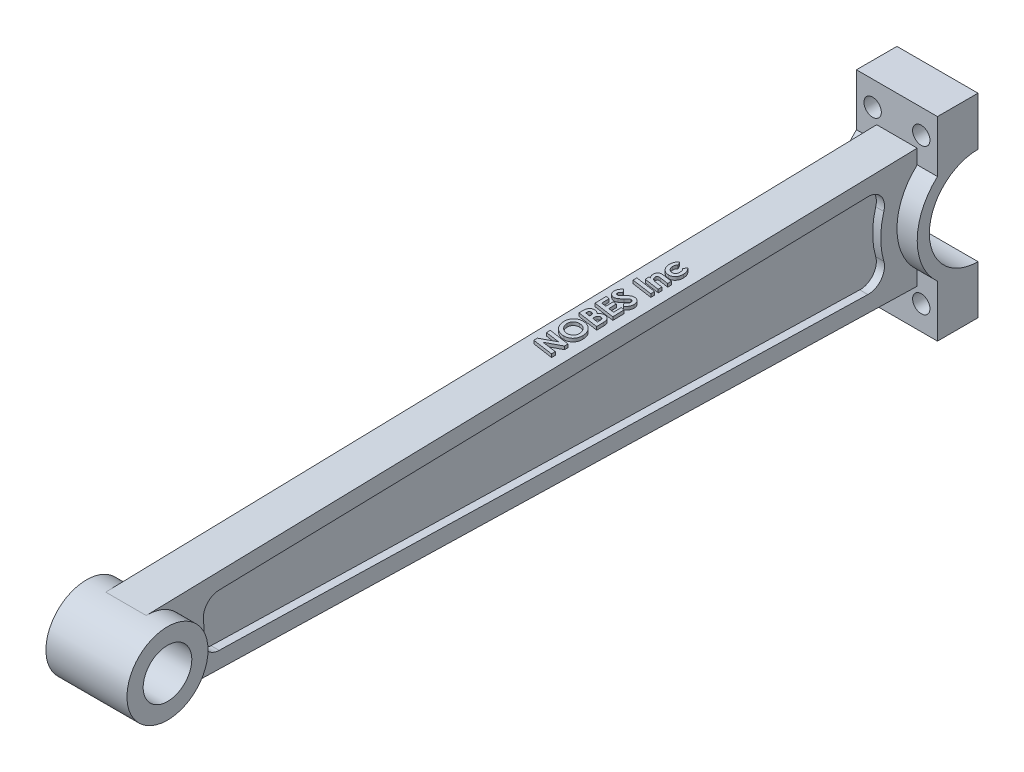
from build123d import *

# Parameters (mm, degrees)
JOURNAL_BOSS_DEPTH      = 25
SKETCH2_R               = 25
SKETCH2_R_2             = 15
PINION_BOSS_DEPTH       = 25
BOSS_EXTRUDE3_DEPTH     = 12.5
CUT_EXTRUDE1_DEPTH      = 5
F_1_2_13_TAPPED_HOLE1_D = 10.71626
BOSS_EXTRUDE4_DEPTH     = 2


with BuildPart() as part:
    # Sketch1 → Journal_Boss (new, symmetric)
    with BuildSketch(Plane(origin=(0, 0, 0), x_dir=(0, 0, -1), z_dir=(1, 0, 0))):
        with BuildLine():
            Line((-25, 27.950849719), (-25, 60))
            Line((-25, 60), (0, 60))
            Line((0, 60), (0, 30))
            ThreePointArc((0, 30), (-30, 0), (0, -30))
            Line((0, -30), (0, -60))
            Line((0, -60), (-25, -60))
            Line((-25, -60), (-25, -27.950849719))
            ThreePointArc((-25, -27.950849719), (-37.5, 0), (-25, 27.950849719))
        make_face()
    extrude(amount=JOURNAL_BOSS_DEPTH, both=True)



with BuildPart() as body_2:
    # Sketch2 → Pinion_Boss (new, symmetric)
    with BuildSketch(Plane(origin=(0, 0, 0), x_dir=(0, 0, -1), z_dir=(1, 0, 0))):
        with Locations((-500, 0)):
            Circle(SKETCH2_R)
        with Locations((-500, 0)):
            Circle(SKETCH2_R_2, mode=Mode.SUBTRACT)
    extrude(amount=PINION_BOSS_DEPTH, both=True)


with BuildPart() as part_1:
    add(part.part)

    add(body_2.part)  # Boss-Extrude3 merges body 2
    # Sketch3 → Boss-Extrude3 (add, symmetric)
    with BuildSketch(Plane(origin=(0, 0, 0), x_dir=(0, 0, -1), z_dir=(1, 0, 0))):
        with BuildLine():
            Line((-500.625, 24.992186279), (-0.9375, 37.488279418))
            ThreePointArc((-0.9375, 37.488279418), (-37.5, 0), (-0.9375, -37.488279418))
            Line((-0.9375, -37.488279418), (-500.625, -24.992186279))
            ThreePointArc((-500.625, -24.992186279), (-475, 0), (-500.625, 24.992186279))
        make_face()
    extrude(amount=BOSS_EXTRUDE3_DEPTH, both=True)

    # Sketch4 → Cut-Extrude1 (cut)
    with BuildSketch(Plane(origin=(12.5, 0, 0), x_dir=(0, 0, -1), z_dir=(1, 0, 0))):
        with BuildLine():
            Line((-55.442636745, 26.122098513), (-455.667618059, 16.113345756))
            ThreePointArc((-455.667618059, 16.113345756), (-463.035515049, 12.594715254), (-465.324814046, 4.757255412))
            ThreePointArc((-465.324814046, 4.757255412), (-465, 0), (-465.324814046, -4.757255412))
            ThreePointArc((-465.324814046, -4.757255412), (-463.035515049, -12.594715254), (-455.667618059, -16.113345756))
            Line((-455.667618059, -16.113345756), (-55.442636745, -26.122098513))
            ThreePointArc((-55.442636745, -26.122098513), (-47.26687423, -22.222952148), (-45.593917311, -13.320837219))
            ThreePointArc((-45.593917311, -13.320837219), (-47.5, 0), (-45.593917311, 13.320837219))
            ThreePointArc((-45.593917311, 13.320837219), (-47.26687423, 22.222952148), (-55.442636745, 26.122098513))
        make_face()
    cut_extrude1 = extrude(amount=-CUT_EXTRUDE1_DEPTH, mode=Mode.SUBTRACT)

    # Mirror1: Cut-Extrude1 across plane
    add(cut_extrude1.mirror(Plane(origin=(0, 0, 0), x_dir=(0, 0, 1), z_dir=(1, 0, 0))), mode=Mode.SUBTRACT)

    # 1/2-13 Tapped Hole1 (through all)
    with Locations(Plane(origin=(0, 0, 0), x_dir=(-1, 0, 0), z_dir=(0, 0, -1))):
        with Locations((-15, 45), (15, 45), (15, -45), (-15, -45)):
            Hole(F_1_2_13_TAPPED_HOLE1_D / 2)

    # Sketch7 → Boss-Extrude4 (add)
    # profile 1 of 8: a face of its own
    with BuildSketch(Plane(origin=(0, 37.488279418, 0.9375), x_dir=(1, 0, 0), z_dir=(0, 0.9996874511566103, 0.02500000000000003))):
        with BuildLine():
            Line((-1.187099359, -156.933974359), (-0.161838942, -158.964142628))
            add(Edge.make_bspline(
                [(-0.161838942, -158.964142628), (-0.243485945, -159.036836256), (-0.404778257, -159.180441323), (-0.610722886, -159.427326263), (-0.785175962, -159.691292325), (-0.928839187, -159.973659167), (-1.041401827, -160.274787813), (-1.118908873, -160.595169141), (-1.169406233, -160.932495458), (-1.174382345, -161.163727221), (-1.176923077, -161.281790865)],
                knots=[0, 0, 0, 0, 1.001621577, 1.978686947, 2.938759667, 3.89892692, 4.878559003, 5.880361798, 6.917742926, 8, 8, 8, 8], degree=3))
            add(Edge.make_bspline(
                [(-1.176923077, -161.281790865), (-1.171795802, -161.440617591), (-1.161789141, -161.750592224), (-1.090749637, -162.202171154), (-0.967215846, -162.624403425), (-0.8002409, -163.019079351), (-0.583875466, -163.379193833), (-0.320361015, -163.699795951), (-0.017899545, -163.986387459), (0.326237406, -164.22690056), (0.695210852, -164.422860292), (1.080982709, -164.564425566), (1.477718329, -164.65177577), (1.746631788, -164.662558773), (1.881049679, -164.667948718)],
                knots=[0, 0, 0, 0, 1.123043621, 2.191791292, 3.222318124, 4.227099582, 5.214441672, 6.18196997, 7.15350446, 8.151822386, 9.141692792, 10.099808168, 11.05017852, 12, 12, 12, 12], degree=3))
            add(Edge.make_bspline(
                [(1.881049679, -164.667948718), (1.965960128, -164.666227666), (2.133062874, -164.662840657), (2.376925371, -164.629311322), (2.608196614, -164.573583039), (2.82519549, -164.493759518), (3.030647435, -164.394607992), (3.222749246, -164.271530937), (3.4007496, -164.125250079), (3.567030561, -163.960553511), (3.714257124, -163.773560097), (3.84426878, -163.570103568), (3.953924228, -163.349981038), (4.043488154, -163.113986929), (4.112146216, -162.860868573), (4.158767117, -162.59077772), (4.190879807, -162.305271202), (4.194368479, -162.109554974), (4.196153846, -162.009395032)],
                knots=[0, 0, 0, 0, 1.023815923, 2.014857467, 2.962663734, 3.888236552, 4.79870464, 5.709632386, 6.633111082, 7.573490415, 8.527295342, 9.497850233, 10.48147211, 11.488436702, 12.538194012, 13.639853934, 14.792169176, 16, 16, 16, 16], degree=3))
            add(Edge.make_bspline(
                [(4.196153846, -162.009395032), (4.192473887, -161.870194104), (4.185337571, -161.600250422), (4.137621744, -161.207093135), (4.052846283, -160.839245036), (3.938067085, -160.493886989), (3.782158646, -160.176428439), (3.599360114, -159.880847541), (3.379631835, -159.611062639), (3.208558038, -159.454825393), (3.12255609, -159.376282051)],
                knots=[0, 0, 0, 0, 1.136921375, 2.204760745, 3.227979435, 4.21579869, 5.169898202, 6.109635441, 7.049678915, 8, 8, 8, 8], degree=3))
            Line((3.12255609, -159.376282051), (4.384415064, -157.491125801))
            add(Edge.make_bspline(
                [(4.384415064, -157.491125801), (4.530377197, -157.627725337), (4.823099519, -157.901671275), (5.201563485, -158.376040068), (5.534595408, -158.894586306), (5.813547256, -159.460591862), (6.038069616, -160.066262155), (6.198637389, -160.709301862), (6.293350179, -161.386663446), (6.306245881, -161.849664664), (6.312820513, -162.085717147)],
                knots=[0, 0, 0, 0, 0.932826368, 1.870753027, 2.825692082, 3.807172292, 4.812381417, 5.837547204, 6.897514017, 8, 8, 8, 8], degree=3))
            add(Edge.make_bspline(
                [(6.312820513, -162.085717147), (6.309848071, -162.269051035), (6.304053528, -162.626446178), (6.24602414, -163.147703757), (6.156241451, -163.638906857), (6.029008426, -164.100906236), (5.863255143, -164.533104812), (5.660232704, -164.935975089), (5.418544357, -165.307828375), (5.144607269, -165.648500486), (4.83960262, -165.954387602), (4.507588467, -166.219210654), (4.153757753, -166.446218755), (3.774490423, -166.630139639), (3.371412172, -166.772181274), (2.945215394, -166.874179231), (2.49600846, -166.936329867), (2.188235977, -166.943682921), (2.03114984, -166.947435897)],
                knots=[0, 0, 0, 0, 1.20349603, 2.346121818, 3.439441078, 4.479782012, 5.488122466, 6.474353572, 7.436663901, 8.395083091, 9.340142733, 10.267246296, 11.178696862, 12.095236905, 13.028740799, 13.979623495, 14.968805986, 16, 16, 16, 16], degree=3))
            add(Edge.make_bspline(
                [(2.03114984, -166.947435897), (1.850229404, -166.94276952), (1.493522649, -166.933569186), (0.969616657, -166.853973651), (0.465318822, -166.730538407), (-0.018329539, -166.553766637), (-0.481731769, -166.325235794), (-0.924997746, -166.047339024), (-1.347158138, -165.718700047), (-1.744329165, -165.344822225), (-2.105636056, -164.929273263), (-2.427038682, -164.483242683), (-2.694212502, -164.004301991), (-2.914135439, -163.498098932), (-3.085066115, -162.962815729), (-3.206921898, -162.398963415), (-3.27842217, -161.805164517), (-3.288460219, -161.399861515), (-3.293589744, -161.192748397)],
                knots=[0, 0, 0, 0, 0.99100305, 1.953883661, 2.897333027, 3.832411954, 4.769797899, 5.724025861, 6.694547792, 7.697294226, 8.708534483, 9.708012297, 10.70472015, 11.707972644, 12.727985423, 13.779024544, 14.865063554, 16, 16, 16, 16], degree=3))
            add(Edge.make_bspline(
                [(-3.293589744, -161.192748397), (-3.29241455, -161.075665553), (-3.290095324, -160.844604361), (-3.263043462, -160.504243216), (-3.224032951, -160.175256219), (-3.16390152, -159.858013641), (-3.091669076, -159.551875722), (-3.001552979, -159.256206403), (-2.895725623, -158.971852865), (-2.770514212, -158.699474011), (-2.629669558, -158.439003856), (-2.475231467, -158.188714207), (-2.300890692, -157.951238486), (-2.10957146, -157.725205536), (-1.90397311, -157.508504978), (-1.680863074, -157.304240127), (-1.442735598, -157.110422124), (-1.272721402, -156.99307325), (-1.187099359, -156.933974359)],
                knots=[0, 0, 0, 0, 1.131133678, 2.232274903, 3.297489358, 4.330962242, 5.350599698, 6.335667611, 7.315883448, 8.280283303, 9.229912559, 10.175857499, 11.119954888, 12.07371199, 13.035881048, 14.00441513, 14.994989487, 16, 16, 16, 16], degree=3))
        make_face()
    # profile 2 of 8: a face of its own
    with BuildSketch(Plane(origin=(0, 37.488279418, 0.9375), x_dir=(1, 0, 0), z_dir=(0, 0.9996874511566103, 0.02500000000000003))):
        with BuildLine():
            Line((-3.130769231, -176.212940705), (-3.130769231, -173.913100962))
            Line((-3.130769231, -173.913100962), (-2.105508814, -174.058112981))
            add(Edge.make_bspline(
                [(-2.105508814, -174.058112981), (-2.199662547, -173.947528764), (-2.383711405, -173.731362094), (-2.624950596, -173.391248728), (-2.834586014, -173.050853504), (-2.998567133, -172.703200162), (-3.131452251, -172.354160134), (-3.224818818, -172.001273247), (-3.284024372, -171.644095287), (-3.290397945, -171.404874602), (-3.293589744, -171.285076122)],
                knots=[0, 0, 0, 0, 1.129074261, 2.207080079, 3.239806547, 4.233987332, 5.191979582, 6.140686111, 7.068880775, 8, 8, 8, 8], degree=3))
            add(Edge.make_bspline(
                [(-3.293589744, -171.285076122), (-3.290749891, -171.184935972), (-3.285175034, -170.98835292), (-3.253138386, -170.700222697), (-3.194204844, -170.426923576), (-3.112242782, -170.16806173), (-3.008184571, -169.921780368), (-2.877472053, -169.691036636), (-2.726487555, -169.471796869), (-2.551922794, -169.270213371), (-2.358877027, -169.087560876), (-2.153100325, -168.926674277), (-1.934557545, -168.790740968), (-1.704904413, -168.677746564), (-1.461594733, -168.591000212), (-1.206520367, -168.530322736), (-0.93966294, -168.494182908), (-0.75811171, -168.489159347), (-0.665564904, -168.486598558)],
                knots=[0, 0, 0, 0, 1.117822813, 2.194374795, 3.23021696, 4.23297143, 5.220966794, 6.208281923, 7.187580337, 8.187472088, 9.178319338, 10.149534865, 11.097600664, 12.045760943, 13.000746163, 13.974080742, 14.967275761, 16, 16, 16, 16], degree=3))
            add(Edge.make_bspline(
                [(-0.665564904, -168.486598558), (-0.56547424, -168.489365603), (-0.343015156, -168.495515572), (0.023030923, -168.520917195), (0.45336808, -168.572590531), (0.761701253, -168.612666648), (0.927023237, -168.634154647)],
                knots=[0, 0, 0, 0, 0.750738588, 1.668573403, 2.749936422, 4, 4, 4, 4], degree=3))
            Line((0.927023237, -168.634154647), (6.15, -169.369391026))
            Line((6.15, -169.369391026), (6.15, -171.669230769))
            Line((6.15, -171.669230769), (1.04150641, -170.949258814))
            add(Edge.make_bspline(
                [(1.04150641, -170.949258814), (0.925381241, -170.933598671), (0.709488132, -170.904484252), (0.407729032, -170.86961612), (0.152130656, -170.851890428), (-0.003242207, -170.847097519), (-0.072796474, -170.844951923)],
                knots=[0, 0, 0, 0, 1.255620443, 2.33437593, 3.254366179, 4, 4, 4, 4], degree=3))
            add(Edge.make_bspline(
                [(-0.072796474, -170.844951923), (-0.156257798, -170.848583908), (-0.31632507, -170.855549552), (-0.542526958, -170.916027876), (-0.736709603, -171.024207086), (-0.899248158, -171.170800669), (-1.026302794, -171.356736922), (-1.11487424, -171.578034658), (-1.168274149, -171.833777413), (-1.173934387, -172.015792419), (-1.176923077, -172.111899038)],
                knots=[0, 0, 0, 0, 1.047771444, 2.009480668, 2.910976547, 3.816306056, 4.735576019, 5.71512598, 6.793552658, 8, 8, 8, 8], degree=3))
            add(Edge.make_bspline(
                [(-1.176923077, -172.111899038), (-1.171744, -172.210715763), (-1.16124618, -172.411014049), (-1.082830269, -172.709438186), (-0.95888688, -173.00681193), (-0.789478732, -173.298913578), (-0.577859137, -173.576559689), (-0.320324247, -173.821095962), (-0.027842142, -174.034698814), (0.249641222, -174.182528277), (0.503850807, -174.28551653), (0.734997109, -174.361879992), (1.004834878, -174.433712344), (1.311696602, -174.507749084), (1.657325588, -174.578151117), (2.039725262, -174.649226387), (2.461253214, -174.718215171), (2.755268533, -174.759212903), (2.908854167, -174.780629006)],
                knots=[0, 0, 0, 0, 0.882126903, 1.788042518, 2.739180213, 3.754112383, 4.79671996, 5.846979855, 6.9153656, 8.023755264, 8.645623767, 9.364388139, 10.197004269, 11.139715799, 12.184303534, 13.34784865, 14.614588017, 16, 16, 16, 16], degree=3))
            Line((2.908854167, -174.780629006), (6.15, -175.230929487))
            Line((6.15, -175.230929487), (6.15, -177.530769231))
            Line((6.15, -177.530769231), (-3.130769231, -176.212940705))
        make_face()
    # profile 3 of 8: a face of its own
    with BuildSketch(Plane(origin=(0, 37.488279418, 0.9375), x_dir=(1, 0, 0), z_dir=(0, 0.9996874511566103, 0.02500000000000003))):
        Polygon((-6.55, -180.308894231), (-6.55, -178.009054487), (6.15, -179.789903846), (6.15, -182.08974359), align=None)
    # profile 4 of 8: a face of its own
    with BuildSketch(Plane(origin=(0, 37.488279418, 0.9375), x_dir=(1, 0, 0), z_dir=(0, 0.9996874511566103, 0.02500000000000003))):
        with BuildLine():
            Line((-4.784415064, -187.958914263), (-3.245252404, -189.724499199))
            add(Edge.make_bspline(
                [(-3.245252404, -189.724499199), (-3.364450694, -189.812738945), (-3.592892021, -189.981848793), (-3.899293396, -190.250191421), (-4.165552499, -190.507273511), (-4.377882697, -190.766229389), (-4.546248252, -191.018637641), (-4.668208812, -191.266697806), (-4.745278319, -191.511804253), (-4.754498527, -191.675300365), (-4.758974359, -191.754667468)],
                knots=[0, 0, 0, 0, 1.358515141, 2.603569235, 3.730126198, 4.746094498, 5.666493297, 6.504166865, 7.273866877, 8, 8, 8, 8], degree=3))
            add(Edge.make_bspline(
                [(-4.758974359, -191.754667468), (-4.755714366, -191.829626189), (-4.749444964, -191.973781798), (-4.696424035, -192.180875099), (-4.610321363, -192.367995005), (-4.489555536, -192.531034675), (-4.346173682, -192.666009818), (-4.18432464, -192.764726483), (-4.007317448, -192.823794149), (-3.885102394, -192.831808863), (-3.82275641, -192.835897436)],
                knots=[0, 0, 0, 0, 1.129837576, 2.172828228, 3.203495929, 4.21975918, 5.215917372, 6.157552582, 7.06010598, 8, 8, 8, 8], degree=3))
            add(Edge.make_bspline(
                [(-3.82275641, -192.835897436), (-3.761363052, -192.832122544), (-3.632234287, -192.824182808), (-3.437086758, -192.766857596), (-3.23199425, -192.678303061), (-3.053344442, -192.572333906), (-2.888323119, -192.457005751), (-2.73096863, -192.329410555), (-2.537825254, -192.17085852), (-2.314345488, -191.972451983), (-2.054897228, -191.742768187), (-1.764377365, -191.473421629), (-1.440343041, -191.169917465), (-1.214068264, -190.954311652), (-1.095512821, -190.841346154)],
                knots=[0, 0, 0, 0, 0.642375858, 1.351110335, 2.114843505, 2.978399569, 3.520371734, 4.222117927, 5.098724586, 6.137079328, 7.350916393, 8.727204589, 10.285236573, 12, 12, 12, 12], degree=3))
            add(Edge.make_bspline(
                [(-1.095512821, -190.841346154), (-1.032122464, -190.78006689), (-0.910488687, -190.662483889), (-0.732846538, -190.497499362), (-0.568205999, -190.35024728), (-0.42233337, -190.214290988), (-0.287696778, -190.097903701), (-0.16752636, -189.998530917), (-0.063513082, -189.914169424), (0.001728388, -189.864294025), (0.031510417, -189.841526442)],
                knots=[0, 0, 0, 0, 1.403722598, 2.693470914, 3.859630393, 4.920438112, 5.867965235, 6.69256451, 7.40316977, 8, 8, 8, 8], degree=3))
            add(Edge.make_bspline(
                [(0.031510417, -189.841526442), (0.156740431, -189.750825257), (0.398271798, -189.575889708), (0.765197342, -189.350001516), (1.117449936, -189.160925797), (1.461668814, -189.014337683), (1.801536297, -188.903452277), (2.141935953, -188.824406041), (2.485007793, -188.773684581), (2.71533318, -188.768143124), (2.829987981, -188.765384615)],
                knots=[0, 0, 0, 0, 1.21504037, 2.343450663, 3.384104216, 4.354772446, 5.280165719, 6.190479454, 7.099229913, 8, 8, 8, 8], degree=3))
            add(Edge.make_bspline(
                [(2.829987981, -188.765384615), (2.956519694, -188.768874171), (3.20553474, -188.775741633), (3.570238727, -188.827862651), (3.920058794, -188.911574673), (4.25343471, -189.031415866), (4.572356063, -189.185746522), (4.875174375, -189.374110354), (5.161492201, -189.597694773), (5.430239795, -189.851118943), (5.675109231, -190.131151866), (5.890988684, -190.43308056), (6.071670039, -190.755043006), (6.221073124, -191.096439364), (6.33448816, -191.457559394), (6.415213941, -191.837512922), (6.468784318, -192.235666465), (6.473323289, -192.508380274), (6.475641026, -192.647636218)],
                knots=[0, 0, 0, 0, 1.019118832, 2.005630972, 2.961771236, 3.912648864, 4.853806034, 5.811214778, 6.780157815, 7.775783696, 8.782923319, 9.77252987, 10.760649478, 11.751976203, 12.769697082, 13.804226645, 14.878771516, 16, 16, 16, 16], degree=3))
            add(Edge.make_bspline(
                [(6.475641026, -192.647636218), (6.473472323, -192.754537204), (6.469179173, -192.96615764), (6.441411143, -193.279930481), (6.391942606, -193.585471362), (6.327851916, -193.884825374), (6.236074841, -194.173991193), (6.133411158, -194.458221446), (6.007213028, -194.73402755), (5.862903213, -195.002647995), (5.699238172, -195.263859297), (5.514738059, -195.516434214), (5.312099878, -195.761507469), (5.091349331, -196.001144082), (4.849687296, -196.230809145), (4.590520525, -196.456018221), (4.309081331, -196.669105679), (4.112720859, -196.80454286), (4.012980769, -196.87333734)],
                knots=[0, 0, 0, 0, 1.003384167, 1.986292206, 2.953313095, 3.907274448, 4.856442329, 5.798273374, 6.742220859, 7.700158449, 8.658591907, 9.6329225, 10.633683023, 11.641885653, 12.688957096, 13.761197951, 14.862814317, 16, 16, 16, 16], degree=3))
            Line((4.012980769, -196.87333734), (2.534875801, -194.993269231))
            add(Edge.make_bspline(
                [(2.534875801, -194.993269231), (2.678864573, -194.899625825), (2.955025884, -194.720023727), (3.327794717, -194.427280592), (3.644606647, -194.128830189), (3.904229863, -193.82358885), (4.106236704, -193.510574554), (4.250632815, -193.192034218), (4.343508171, -192.866550174), (4.353832711, -192.645687363), (4.358974359, -192.535697115)],
                knots=[0, 0, 0, 0, 1.289844872, 2.473840458, 3.555310637, 4.554525788, 5.477014656, 6.343795492, 7.175205895, 8, 8, 8, 8], degree=3))
            add(Edge.make_bspline(
                [(4.358974359, -192.535697115), (4.354173028, -192.434324034), (4.344836834, -192.237203913), (4.269182518, -191.952877173), (4.140199216, -191.69553942), (3.963879, -191.470049393), (3.755402226, -191.282157674), (3.519217391, -191.142445981), (3.258293401, -191.061455341), (3.077308412, -191.050466015), (2.985176282, -191.044871795)],
                knots=[0, 0, 0, 0, 1.077805225, 2.095794002, 3.104861694, 4.121248852, 5.124852786, 6.075306709, 7.020216575, 8, 8, 8, 8], degree=3))
            add(Edge.make_bspline(
                [(2.985176282, -191.044871795), (2.910237737, -191.047450275), (2.757798922, -191.052695378), (2.5301505, -191.108472573), (2.29865526, -191.189183213), (2.103658511, -191.28937325), (1.933269673, -191.395548579), (1.780862206, -191.510651941), (1.599540673, -191.652192528), (1.395809259, -191.828987797), (1.162363979, -192.032072955), (0.907727979, -192.269589115), (0.623370028, -192.533804838), (0.428818472, -192.723521123), (0.326622596, -192.823177083)],
                knots=[0, 0, 0, 0, 0.822266223, 1.672641084, 2.563102877, 3.513656615, 4.074932854, 4.768551394, 5.611536013, 6.603473327, 7.733010352, 9.012917102, 10.43091692, 12, 12, 12, 12], degree=3))
            add(Edge.make_bspline(
                [(0.326622596, -192.823177083), (0.217533368, -192.928652137), (0.006646447, -193.13255228), (-0.30198516, -193.421016378), (-0.589242735, -193.680853965), (-0.855428542, -193.911770826), (-1.101021078, -194.113957705), (-1.324157224, -194.290913142), (-1.527780475, -194.437281223), (-1.6598961, -194.519831916), (-1.721354167, -194.558233173)],
                knots=[0, 0, 0, 0, 1.354401886, 2.618275412, 3.770529779, 4.811580489, 5.763301005, 6.60974666, 7.35327647, 8, 8, 8, 8], degree=3))
            add(Edge.make_bspline(
                [(-1.721354167, -194.558233173), (-1.874498342, -194.643975862), (-2.17162448, -194.81033148), (-2.63927322, -194.981831789), (-3.100913908, -195.09359181), (-3.409164171, -195.10820162), (-3.560717147, -195.115384615)],
                knots=[0, 0, 0, 0, 1.081804801, 2.098888081, 3.065307629, 4, 4, 4, 4], degree=3))
            add(Edge.make_bspline(
                [(-3.560717147, -195.115384615), (-3.65835711, -195.11280544), (-3.852581238, -195.107674979), (-4.139230497, -195.070739619), (-4.419529602, -195.01418589), (-4.689226903, -194.924029922), (-4.955075632, -194.820054087), (-5.210090344, -194.684144761), (-5.461131756, -194.531450135), (-5.616646104, -194.40894795), (-5.695192308, -194.347075321)],
                knots=[0, 0, 0, 0, 1.012167245, 2.013389743, 2.992947912, 3.971795425, 4.958040075, 5.949133471, 6.964161297, 8, 8, 8, 8], degree=3))
            add(Edge.make_bspline(
                [(-5.695192308, -194.347075321), (-5.789855618, -194.265398091), (-5.976565781, -194.104301159), (-6.215234434, -193.825572884), (-6.421389852, -193.53004341), (-6.5868911, -193.211351303), (-6.718797519, -192.873161252), (-6.808304858, -192.51225682), (-6.866779623, -192.131403927), (-6.872645671, -191.870224103), (-6.875641026, -191.736858974)],
                knots=[0, 0, 0, 0, 1.010152455, 1.992384693, 2.959065588, 3.919519142, 4.890305168, 5.888624478, 6.921877408, 8, 8, 8, 8], degree=3))
            add(Edge.make_bspline(
                [(-6.875641026, -191.736858974), (-6.869223854, -191.552424698), (-6.856565045, -191.188601101), (-6.757539405, -190.653548617), (-6.591251141, -190.142600875), (-6.359526405, -189.654961574), (-6.064326118, -189.190665059), (-5.701499537, -188.751704996), (-5.27480549, -188.33359358), (-4.95092411, -188.086134315), (-4.784415064, -187.958914263)],
                knots=[0, 0, 0, 0, 0.984501076, 1.942072434, 2.894457216, 3.846572772, 4.817734018, 5.824961421, 6.881801732, 8, 8, 8, 8], degree=3))
        make_face()
    # profile 5 of 8: a face of its own
    with BuildSketch(Plane(origin=(0, 37.488279418, 0.9375), x_dir=(1, 0, 0), z_dir=(0, 0.9996874511566103, 0.02500000000000003))):
        Polygon((-6.55, -203.755048077), (-6.55, -196.906410256), (-4.433333333, -197.17353766), (-4.433333333, -201.750320513), (-1.502564103, -202.162459936), (-1.502564103, -197.542427885), (0.614102564, -197.812099359), (0.614102564, -202.460116186), (4.033333333, -202.938401442), (4.033333333, -198.242047276), (6.15, -198.509174679), (6.15, -205.535897436), align=None)
    # profile 6 of 8: a face of its own
    with BuildSketch(Plane(origin=(0, 37.488279418, 0.9375), x_dir=(1, 0, 0), z_dir=(0, 0.9996874511566103, 0.02500000000000003))):
        with BuildLine():
            Line((-6.55, -213.687099359), (-6.55, -211.784134615))
            add(Edge.make_bspline(
                [(-6.55, -211.784134615), (-6.549704534, -211.644165986), (-6.549132947, -211.373393427), (-6.52551516, -210.981693461), (-6.50128648, -210.616256557), (-6.456203902, -210.279687844), (-6.40600719, -209.969547798), (-6.334184144, -209.689756359), (-6.262348421, -209.434124359), (-6.138123992, -209.136311304), (-5.952145954, -208.797988586), (-5.675497362, -208.431538964), (-5.338929916, -208.1126269), (-4.960239075, -207.834229283), (-4.545777728, -207.607740791), (-4.106592619, -207.447269981), (-3.651802564, -207.346033017), (-3.342446951, -207.333321283), (-3.186738782, -207.326923077)],
                knots=[0, 0, 0, 0, 1.060006148, 2.050606466, 2.971924737, 3.833242148, 4.62214224, 5.349735957, 6.020401181, 6.631169854, 7.789826067, 8.935859303, 10.094373048, 11.289270369, 12.487908838, 13.658558586, 14.821480722, 16, 16, 16, 16], degree=3))
            add(Edge.make_bspline(
                [(-3.186738782, -207.326923077), (-3.055900672, -207.331666537), (-2.796921574, -207.341055676), (-2.413928789, -207.405867377), (-2.043549478, -207.516025989), (-1.687041801, -207.669430176), (-1.349100105, -207.860923081), (-1.038153691, -208.095344227), (-0.756233355, -208.368360824), (-0.594526442, -208.575722859), (-0.512920673, -208.68036859)],
                knots=[0, 0, 0, 0, 1.008845348, 1.996894151, 2.985981276, 3.982091695, 4.983874953, 5.97399931, 6.977574058, 8, 8, 8, 8], degree=3))
            add(Edge.make_bspline(
                [(-0.512920673, -208.68036859), (-0.413346484, -208.546403843), (-0.218877834, -208.284770345), (0.117722869, -207.94292814), (0.476408483, -207.651628679), (0.859872708, -207.413148224), (1.268974391, -207.228290658), (1.701344613, -207.09591905), (2.158678145, -207.014484741), (2.471780297, -207.005742867), (2.631550481, -207.001282051)],
                knots=[0, 0, 0, 0, 1.076913361, 2.103214583, 3.08854249, 4.055123362, 5.011032764, 5.979411754, 6.968931531, 8, 8, 8, 8], degree=3))
            add(Edge.make_bspline(
                [(2.631550481, -207.001282051), (2.798252597, -207.007519656), (3.12789894, -207.019854255), (3.610889071, -207.121979489), (4.071422051, -207.291874621), (4.501967472, -207.526284051), (4.896238604, -207.804346136), (5.237993186, -208.123210297), (5.52597098, -208.471182178), (5.722067051, -208.789945185), (5.846957958, -209.067682681), (5.928142652, -209.297539135), (5.996293017, -209.549485234), (6.055182558, -209.822649048), (6.097243229, -210.118605797), (6.126612658, -210.435330671), (6.148788302, -210.773829884), (6.149587608, -211.007305575), (6.15, -211.127764423)],
                knots=[0, 0, 0, 0, 1.303717539, 2.578045976, 3.844259799, 5.133024785, 6.403753124, 7.610617642, 8.779942312, 9.929587522, 10.526662712, 11.160630066, 11.835293962, 12.568168347, 13.346288436, 14.173125839, 15.057447234, 16, 16, 16, 16], degree=3))
            Line((6.15, -211.127764423), (6.15, -215.467948718))
            Line((6.15, -215.467948718), (-6.55, -213.687099359))
        make_face()
        with BuildLine():
            Line((-1.502564103, -212.099599359), (-1.502564103, -211.682371795))
            add(Edge.make_bspline(
                [(-1.502564103, -211.682371795), (-1.502941144, -211.606888244), (-1.503661548, -211.462663419), (-1.512067426, -211.256584281), (-1.52179133, -211.069080368), (-1.535075715, -210.900661202), (-1.559631577, -210.750801782), (-1.584528592, -210.620116675), (-1.610011245, -210.506474015), (-1.65997204, -210.38285442), (-1.734473654, -210.241904738), (-1.861619093, -210.093728872), (-2.014709592, -209.95439426), (-2.199886246, -209.835650386), (-2.403298337, -209.734211631), (-2.621187917, -209.659576367), (-2.850836052, -209.61537465), (-3.007612367, -209.609436755), (-3.087520032, -209.606410256)],
                knots=[0, 0, 0, 0, 1.199399338, 2.291666987, 3.276857544, 4.183332224, 4.974267597, 5.687835637, 6.299007753, 6.819519814, 7.802496043, 8.817017663, 9.904787279, 11.082105911, 12.29946324, 13.509714364, 14.730720832, 16, 16, 16, 16], degree=3))
            add(Edge.make_bspline(
                [(-3.087520032, -209.606410256), (-3.160615553, -209.608764459), (-3.303609352, -209.613369891), (-3.510098979, -209.651797312), (-3.701250726, -209.715782679), (-3.873744452, -209.804172195), (-4.024249745, -209.913827711), (-4.151864121, -210.039836299), (-4.252287889, -210.18360971), (-4.313278802, -210.31972945), (-4.349983632, -210.443911928), (-4.372276198, -210.558934417), (-4.388330204, -210.695177196), (-4.40752306, -210.851787982), (-4.419416938, -211.030095212), (-4.426306756, -211.229482188), (-4.43150613, -211.449988987), (-4.432706716, -211.604350559), (-4.433333333, -211.684915865)],
                knots=[0, 0, 0, 0, 1.217283007, 2.381321311, 3.485046251, 4.565736305, 5.59736627, 6.576566308, 7.540869185, 8.502164928, 9.047613084, 9.696082543, 10.451507722, 11.33317058, 12.324832099, 13.427833167, 14.657519431, 16, 16, 16, 16], degree=3))
            Line((-4.433333333, -211.684915865), (-1.502564103, -212.099599359))
        make_face(mode=Mode.SUBTRACT)
        with BuildLine():
            Line((4.033333333, -212.870452724), (4.084214744, -211.399979968))
            add(Edge.make_bspline(
                [(4.084214744, -211.399979968), (4.082678541, -211.310893068), (4.079704366, -211.13841584), (4.058929671, -210.888703394), (4.027365004, -210.657139002), (3.979592902, -210.444903484), (3.915453494, -210.252699078), (3.839033314, -210.07888722), (3.751362814, -209.921535336), (3.644291057, -209.786845225), (3.530632464, -209.664905037), (3.401935352, -209.56426571), (3.266240859, -209.476226275), (3.119484366, -209.404129617), (2.962058938, -209.349338222), (2.794571856, -209.30718153), (2.616877666, -209.285246978), (2.495070434, -209.282278932), (2.433112981, -209.280769231)],
                knots=[0, 0, 0, 0, 1.396967498, 2.704607306, 3.927105332, 5.059476533, 6.110856798, 7.099288457, 8.0345797, 8.925713636, 9.791070493, 10.642623605, 11.480039901, 12.324606542, 13.199516658, 14.089757027, 15.028351696, 16, 16, 16, 16], degree=3))
            add(Edge.make_bspline(
                [(2.433112981, -209.280769231), (2.341273558, -209.284972238), (2.161773537, -209.293187011), (1.898716732, -209.349485324), (1.653809174, -209.451254274), (1.424451037, -209.585645751), (1.218922464, -209.75182562), (1.045314179, -209.949387311), (0.905125465, -210.172027797), (0.814574886, -210.379754002), (0.75642069, -210.56867882), (0.723823496, -210.74308471), (0.68913813, -210.9454121), (0.666452221, -211.178480864), (0.64177971, -211.439446647), (0.628284625, -211.730610249), (0.617716084, -212.051187625), (0.615342871, -212.275129313), (0.614102564, -212.392167468)],
                knots=[0, 0, 0, 0, 1.072622611, 2.096439365, 3.122744367, 4.15723709, 5.19210906, 6.195602288, 7.215049995, 8.252903698, 8.832552919, 9.520188734, 10.322946655, 11.229686895, 12.253743166, 13.384425235, 14.63302787, 16, 16, 16, 16], degree=3))
            Line((0.614102564, -212.392167468), (4.033333333, -212.870452724))
        make_face(mode=Mode.SUBTRACT)
    # profile 7 of 8: a face of its own
    with BuildSketch(Plane(origin=(0, 37.488279418, 0.9375), x_dir=(1, 0, 0), z_dir=(0, 0.9996874511566103, 0.02500000000000003))):
        with BuildLine():
            add(Edge.make_bspline(
                [(-6.875641026, -222.807592147), (-6.871149387, -222.593634805), (-6.862330189, -222.173535926), (-6.781213325, -221.557748118), (-6.6503749, -220.970322122), (-6.463086871, -220.412466174), (-6.225487481, -219.883240367), (-5.937043762, -219.380472268), (-5.591473538, -218.909483632), (-5.198324374, -218.470992194), (-4.764968559, -218.072609173), (-4.299320178, -217.723093666), (-3.804133275, -217.427237337), (-3.27949, -217.188674143), (-2.728087774, -216.997825661), (-2.146709867, -216.868459856), (-1.539034719, -216.782893624), (-1.123800452, -216.774690377), (-0.912339744, -216.770512821)],
                knots=[0, 0, 0, 0, 1.079836913, 2.12022767, 3.129873305, 4.114226095, 5.085878962, 6.054574521, 7.035167323, 8.029719972, 9.02368258, 10.002478943, 10.964423001, 11.930047782, 12.907663438, 13.904784223, 14.932997955, 16, 16, 16, 16], degree=3))
            add(Edge.make_bspline(
                [(-0.912339744, -216.770512821), (-0.74769986, -216.773190752), (-0.420243889, -216.778516951), (0.066651314, -216.82919288), (0.546631583, -216.908151635), (1.019859925, -217.0162198), (1.484727098, -217.161047515), (1.943609712, -217.333039148), (2.394094712, -217.540481758), (2.834784806, -217.776174257), (3.259861346, -218.036484055), (3.663732784, -218.318920444), (4.04020366, -218.625157949), (4.392581153, -218.950219579), (4.716084917, -219.29891404), (5.017654225, -219.664199329), (5.290381549, -220.05405192), (5.539529698, -220.462255894), (5.760835696, -220.889710198), (5.952559021, -221.333369845), (6.111259873, -221.793461047), (6.248740784, -222.266301507), (6.34864358, -222.757571971), (6.422783896, -223.262823027), (6.46650148, -223.784593919), (6.472563514, -224.137212246), (6.475641026, -224.316225962)],
                knots=[0, 0, 0, 0, 1.005317745, 1.999499088, 2.986408362, 3.975218675, 4.961516123, 5.958150076, 6.966372406, 7.988272221, 9.008963681, 10.009104341, 10.996000023, 11.970916314, 12.934720706, 13.899012095, 14.861813887, 15.838063901, 16.817989402, 17.799392179, 18.787170953, 19.788919773, 20.804750236, 21.846372664, 22.906668198, 24, 24, 24, 24], degree=3))
            add(Edge.make_bspline(
                [(6.475641026, -224.316225962), (6.470682646, -224.537747407), (6.461003085, -224.970193138), (6.387716576, -225.601607011), (6.259367688, -226.197212808), (6.084963476, -226.760502732), (5.856696486, -227.289193631), (5.582382007, -227.786873975), (5.251484282, -228.246085749), (4.874405839, -228.667755669), (4.459707959, -229.050009219), (4.005309337, -229.378468033), (3.523028421, -229.662054666), (3.005082688, -229.887054528), (2.457795985, -230.067090396), (1.878028835, -230.192524951), (1.266691095, -230.270966289), (0.848402284, -230.279996563), (0.634455128, -230.284615385)],
                knots=[0, 0, 0, 0, 1.12907138, 2.20413016, 3.234265933, 4.230953244, 5.204968906, 6.164780116, 7.122066798, 8.08343425, 9.044179508, 9.990955458, 10.936259871, 11.890457388, 12.863762951, 13.868554151, 14.909804029, 16, 16, 16, 16], degree=3))
            add(Edge.make_bspline(
                [(0.634455128, -230.284615385), (0.389900051, -230.279075954), (-0.09164197, -230.26816852), (-0.800407536, -230.171977643), (-1.48399708, -230.025845677), (-2.139288208, -229.807766435), (-2.770251571, -229.536891507), (-3.373049848, -229.199994999), (-3.952448218, -228.806102094), (-4.308961846, -228.498891084), (-4.489302885, -228.343489583)],
                knots=[0, 0, 0, 0, 1.04575617, 2.059149804, 3.054722987, 4.032197999, 5.008770418, 5.988027961, 6.982251733, 8, 8, 8, 8], degree=3))
            add(Edge.make_bspline(
                [(-4.489302885, -228.343489583), (-4.587084692, -228.253030937), (-4.780887771, -228.073742329), (-5.050209968, -227.78680105), (-5.302369428, -227.492839489), (-5.534333057, -227.187678816), (-5.751635551, -226.875993466), (-5.946889002, -226.552572917), (-6.124055885, -226.219855496), (-6.279962144, -225.877527267), (-6.421831782, -225.526700621), (-6.543483631, -225.166591772), (-6.645191944, -224.796020557), (-6.728987983, -224.416443777), (-6.795719172, -224.027731662), (-6.840479455, -223.629303897), (-6.86945202, -223.221855786), (-6.873562519, -222.946717815), (-6.875641026, -222.807592147)],
                knots=[0, 0, 0, 0, 1.027834056, 2.037162222, 3.035329466, 4.01585125, 4.994448725, 5.96654557, 6.929854793, 7.902193993, 8.868456083, 9.84954569, 10.834057117, 11.832932274, 12.84871259, 13.876546647, 14.926259203, 16, 16, 16, 16], degree=3))
        make_face()
        with BuildLine():
            add(Edge.make_bspline(
                [(-4.758974359, -222.861017628), (-4.757248941, -222.976431643), (-4.753816235, -223.206046916), (-4.719295316, -223.545904428), (-4.665808079, -223.878924851), (-4.592506889, -224.203708918), (-4.497903827, -224.521814948), (-4.380992182, -224.831076838), (-4.242632694, -225.133780775), (-4.0829771, -225.426584862), (-3.904951458, -225.710488705), (-3.70622516, -225.979499431), (-3.489858813, -226.235750814), (-3.251670227, -226.473576411), (-2.999238156, -226.70216911), (-2.72707407, -226.915339065), (-2.435209794, -227.114348447), (-2.128123192, -227.298735892), (-1.808515487, -227.462337356), (-1.485660692, -227.608439387), (-1.159360318, -227.731009271), (-0.830119617, -227.82977464), (-0.499144505, -227.909778626), (-0.165043875, -227.965356218), (0.171546514, -227.999839366), (0.396926765, -228.003363395), (0.509795673, -228.005128205)],
                knots=[0, 0, 0, 0, 1.015497732, 2.020324729, 3.003179514, 3.982741453, 4.948558492, 5.921701682, 6.890254549, 7.875486937, 8.854935133, 9.837194617, 10.816756557, 11.803683727, 12.797277025, 13.812582742, 14.843541928, 15.904669685, 16.96285351, 18.001832494, 19.022146151, 20.027998242, 21.025480483, 22.016912908, 23.006883374, 24, 24, 24, 24], degree=3))
            add(Edge.make_bspline(
                [(0.509795673, -228.005128205), (0.641388118, -228.002342832), (0.900303464, -227.996862456), (1.281442819, -227.949107567), (1.648387924, -227.875115611), (1.998099762, -227.763151147), (2.334351443, -227.62709942), (2.652147103, -227.454378788), (2.957658656, -227.255759764), (3.243546791, -227.025173262), (3.506639726, -226.766291215), (3.737814232, -226.478094678), (3.928106349, -226.159028), (4.087400446, -225.816728106), (4.209223868, -225.445928687), (4.298425564, -225.049128163), (4.348524002, -224.624493017), (4.355430967, -224.3333141), (4.358974359, -224.183934295)],
                knots=[0, 0, 0, 0, 1.032489097, 2.031478859, 3.010556481, 3.966323203, 4.909467292, 5.853480043, 6.800561925, 7.766289623, 8.731168209, 9.692735003, 10.657338041, 11.640119341, 12.650464756, 13.714650797, 14.827576452, 16, 16, 16, 16], degree=3))
            add(Edge.make_bspline(
                [(4.358974359, -224.183934295), (4.354816424, -224.009013681), (4.346606144, -223.663614521), (4.274273776, -223.156121436), (4.152360921, -222.669850998), (3.992306835, -222.201169294), (3.774193365, -221.756550493), (3.514803357, -221.329133365), (3.204431646, -220.923982357), (2.853080091, -220.543102719), (2.469456512, -220.193271706), (2.059499396, -219.887458712), (1.628564328, -219.62775379), (1.177604559, -219.416163357), (0.70585817, -219.252448817), (0.214154757, -219.135742549), (-0.297836206, -219.062094039), (-0.646657767, -219.054065544), (-0.823297276, -219.05)],
                knots=[0, 0, 0, 0, 1.033665568, 2.041081436, 3.022262484, 3.99412766, 4.962716302, 5.94369243, 6.945316814, 7.974169594, 9.003339857, 10.009957158, 10.992622596, 11.972637593, 12.949236147, 13.938972816, 14.956317871, 16, 16, 16, 16], degree=3))
            add(Edge.make_bspline(
                [(-0.823297276, -219.05), (-0.968479195, -219.052341642), (-1.253002997, -219.056930733), (-1.66728539, -219.110055909), (-2.060066824, -219.190486957), (-2.431448855, -219.304715009), (-2.779722453, -219.455073576), (-3.10631423, -219.637362932), (-3.410514511, -219.851566943), (-3.689001869, -220.098451642), (-3.941814544, -220.370132516), (-4.160511585, -220.665683632), (-4.346358381, -220.981835345), (-4.494775122, -221.3191253), (-4.617060921, -221.674939825), (-4.699501642, -222.052244534), (-4.748129173, -222.450145562), (-4.755299681, -222.721801727), (-4.758974359, -222.861017628)],
                knots=[0, 0, 0, 0, 1.12828835, 2.211190558, 3.241921266, 4.243055431, 5.226662917, 6.186101649, 7.146604826, 8.113694903, 9.074944753, 10.027150231, 10.966968433, 11.920383264, 12.887945329, 13.887840882, 14.917579742, 16, 16, 16, 16], degree=3))
        make_face(mode=Mode.SUBTRACT)
    # profile 8 of 8: a face of its own
    with BuildSketch(Plane(origin=(0, 37.488279418, 0.9375), x_dir=(1, 0, 0), z_dir=(0, 0.9996874511566103, 0.02500000000000003))):
        Polygon((-6.55, -241.544671474), (-6.55, -239.405108173), (2.084575321, -234.925), (-6.55, -233.714022436), (-6.55, -231.414182692), (6.15, -233.192487981), (6.15, -235.314242788), (-2.578705929, -239.809615385), (6.15, -241.030769231), (6.15, -243.330608974), align=None)
    extrude(amount=BOSS_EXTRUDE4_DEPTH)


solid = part_1.part
